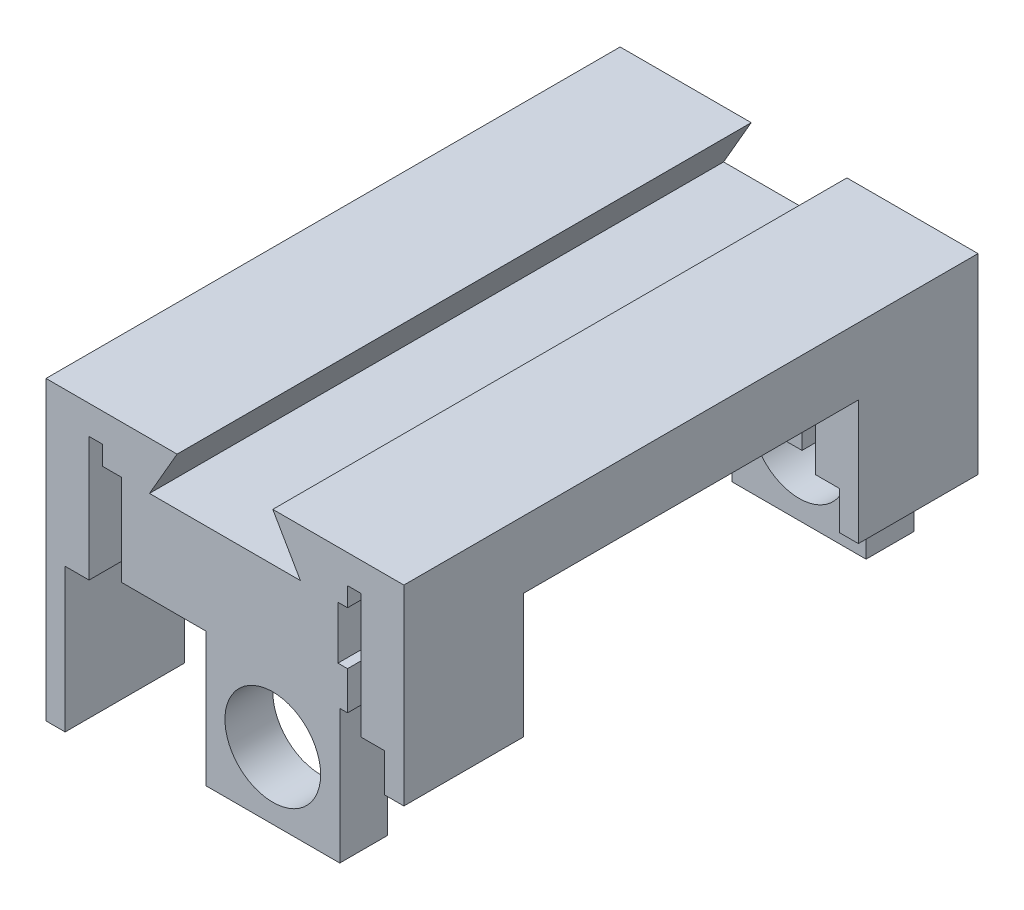
from build123d import *

# Parameters (mm, degrees)
BOSS_EXTRUDE1_DEPTH = 76.2
SKETCH2_W           = 2.54
SKETCH2_H           = 19.05
BOSS_EXTRUDE2_DEPTH = 76.2
SKETCH3_W           = 17.78
SKETCH3_H           = 17.78
SKETCH3_R           = 6.35
BOSS_EXTRUDE3_DEPTH = 6.35
CUT_EXTRUDE1_DEPTH  = 84.75926815
SKETCH5_W           = 44.45
SKETCH5_H           = 30.48
CUT_EXTRUDE2_DEPTH  = 94.314843428
CUT_EXTRUDE3_START  = -76.2
SKETCH6_W           = 2.54
SKETCH6_H           = 12.08
CUT_EXTRUDE3_DEPTH  = 76.2


with BuildPart() as part:
    # Sketch1 → Boss-Extrude1 (new body)
    with BuildSketch(Plane.XY):
        Polygon((-16.27, 6.97), (16.27, 6.97), (16.27, 12.05), (15, 12.05), (15, 19.05), (16.27, 19.05), (16.27, 21.59), (18.034, 21.59), (18.034, 5.08), (21.209, 5.08), (21.209, 0), (23.749, 0), (23.749, 25.4), (-23.749, 25.4), (-23.749, 0), (-21.209, 0), (-21.209, 5.08), (-18.034, 5.08), (-18.034, 21.59), (-16.27, 21.59), (-16.27, 19.05), (-15, 19.05), (-15, 12.05), (-16.27, 12.05), align=None)
    extrude(amount=BOSS_EXTRUDE1_DEPTH)

    # Sketch2 → Boss-Extrude2 (add)
    with BuildSketch(Plane.XY.offset(76.2)):
        with Locations((-22.479, -4.445)):
            Rectangle(SKETCH2_W, SKETCH2_H)
    extrude(amount=-BOSS_EXTRUDE2_DEPTH)

    # Sketch3 → Boss-Extrude3 (add)
    with BuildSketch(Plane.XY.offset(76.2)):
        with Locations((6.35, -1.92)):
            Rectangle(SKETCH3_W, SKETCH3_H)
        with Locations((6.35, -1.92)):
            Circle(SKETCH3_R, mode=Mode.SUBTRACT)
    boss_extrude3 = extrude(amount=-BOSS_EXTRUDE3_DEPTH)

    # Mirror1: Boss-Extrude3 across plane
    add(boss_extrude3.mirror(Plane.XY.offset(38.1)))

    # Sketch4 → Cut-Extrude1 (cut, through all)
    with BuildSketch(Plane.XY.offset(76.2)):
        Polygon((-6.35, 25.4), (-10.016174209, 19.05), (10.016174209, 19.05), (6.35, 25.4), align=None)
    extrude(amount=-CUT_EXTRUDE1_DEPTH, mode=Mode.SUBTRACT)

    # Sketch5 → Cut-Extrude2 (cut, through all)
    with BuildSketch(Plane(origin=(23.749, 0, 0), x_dir=(0, 0, -1), z_dir=(1, 0, 0))):
        with Locations((-38.1, 1.27)):
            Rectangle(SKETCH5_W, SKETCH5_H)
    extrude(amount=-CUT_EXTRUDE2_DEPTH, mode=Mode.SUBTRACT)

    # Sketch6 → Cut-Extrude3 (cut)
    with BuildSketch(Plane.XY.offset(76.2).offset(CUT_EXTRUDE3_START)):
        with Locations((-15, 13.01)):
            Rectangle(SKETCH6_W, SKETCH6_H)
    extrude(amount=CUT_EXTRUDE3_DEPTH, mode=Mode.SUBTRACT)


solid = part.part
